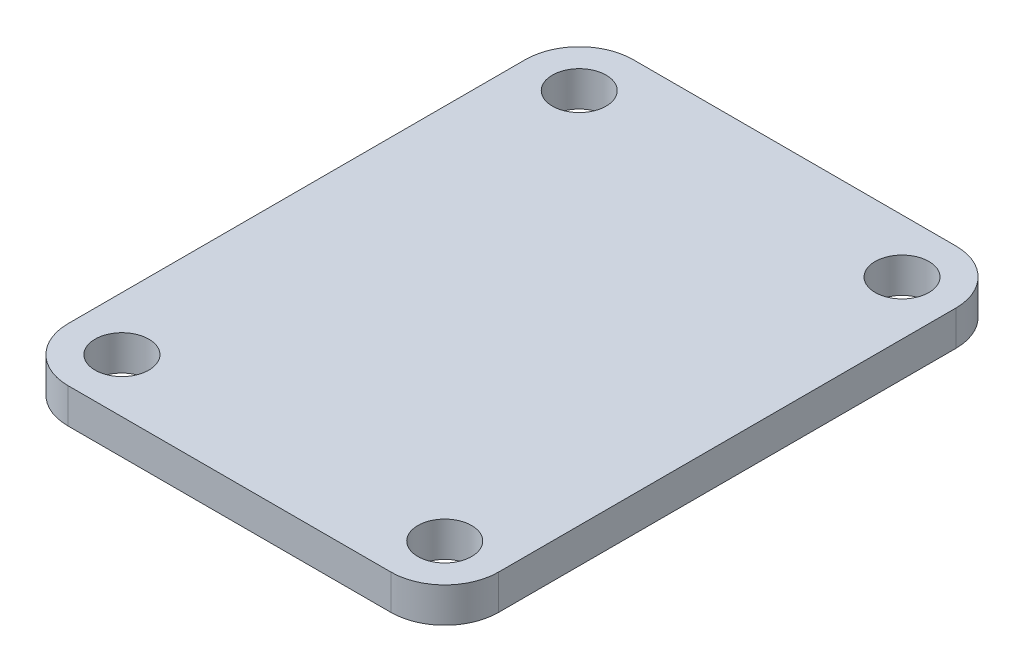
from build123d import *

# Parameters (mm, degrees)
SKETCH1_W           = 20.32
SKETCH1_H           = 26.67
SKETCH1_R           = 1.27
BOSS_EXTRUDE1_DEPTH = 1.651
FILLET1_R           = 2.54


with BuildPart() as part:
    # Sketch1 → Boss-Extrude1 (new body)
    with BuildSketch(Plane(origin=(0, 0, 0), x_dir=(1, 0, 0), z_dir=(0, 1, 0))):
        Rectangle(SKETCH1_W, SKETCH1_H)
        with Locations(Location((-7.62, 10.795, 0), (0, 0, 90))):
            Circle(SKETCH1_R, mode=Mode.SUBTRACT)
        with Locations(Location((7.62, 10.795, 0), (0, 0, 90))):
            Circle(SKETCH1_R, mode=Mode.SUBTRACT)
        with Locations(Location((7.62, -10.795, 0), (0, 0, 90))):
            Circle(SKETCH1_R, mode=Mode.SUBTRACT)
        with Locations(Location((-7.62, -10.795, 0), (0, 0, 90))):
            Circle(SKETCH1_R, mode=Mode.SUBTRACT)
    extrude(amount=BOSS_EXTRUDE1_DEPTH)

    # Fillet1
    fillet1_edges = [part.edges().sort_by_distance(p)[0] for p in [
        (-10.16, 0.8255, -13.335),
        (10.16, 0.8255, -13.335),
        (10.16, 0.8255, 13.335),
        (-10.16, 0.8255, 13.335),
    ]]
    fillet(fillet1_edges, radius=FILLET1_R)


solid = part.part
